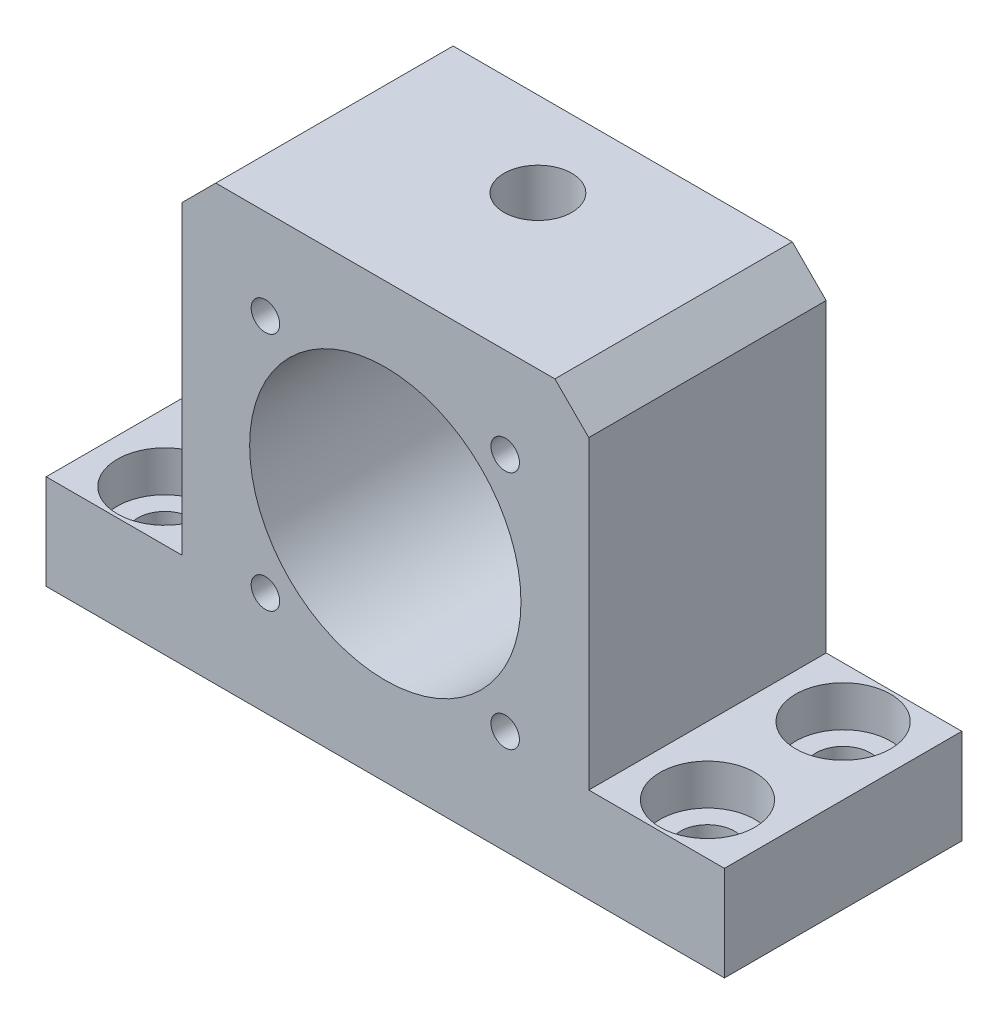
from build123d import *

# Parameters (mm, degrees)
SKETCH_1_R                   = 20
EXTRUDE_1_DEPTH              = 17.5
HOLE_WIZARD_M6_1_D           = 8
HOLE_WIZARD_M6_1_CBORE_D     = 14
HOLE_WIZARD_M6_1_CBORE_DEPTH = 6
HOLE_WIZARD_M5_1_D           = 4.2
HOLE_WIZARD_M5_1_DEPTH       = 12.4
HOLE_WIZARD_M5_1_TIP         = 1.2618073
CUT_EXTRUDE_2_REACH          = 85.08
CUT_EXTRUDE_2_END_RADIUS     = 20
SKETCH_5_R                   = 5


with BuildPart() as part:
    # 草图1 → 拉伸1 (new, symmetric)
    with BuildSketch(Plane.XY):
        Polygon((30, 14), (50, 14), (50, 0), (-50, 0), (-50, 14), (-30, 14), (-30, 59), (-25, 64), (25, 64), (30, 59), align=None)
        with Locations((0, 33)):
            Circle(SKETCH_1_R, mode=Mode.SUBTRACT)
    extrude(amount=EXTRUDE_1_DEPTH, both=True)

    # M6 六角凹头螺钉的柱形沉头孔1 (through all)
    with Locations(Plane(origin=(-40, 14, 10), x_dir=(0, 0, 1), z_dir=(0, 1, 0))):
        with Locations((0, 0), (-20, 0), (-20, 80), (0, 80)):
            CounterBoreHole(HOLE_WIZARD_M6_1_D / 2, HOLE_WIZARD_M6_1_CBORE_D / 2, HOLE_WIZARD_M6_1_CBORE_DEPTH)

    # M5 螺纹孔1
    with Locations(Plane(origin=(-17.67766953, 15.32233047, 17.5), x_dir=(1, 0, 0), z_dir=(0, 0, 1))):
        with Locations((0, 0), (35.35533906, 0), (35.35533906, 35.35533906), (0, 35.35533906)):
            Hole(HOLE_WIZARD_M5_1_D / 2, depth=HOLE_WIZARD_M5_1_DEPTH)
            with Locations((0, 0, -(HOLE_WIZARD_M5_1_DEPTH + HOLE_WIZARD_M5_1_TIP / 2))):  # 118° drill point
                Cone(0, HOLE_WIZARD_M5_1_D / 2, HOLE_WIZARD_M5_1_TIP, mode=Mode.SUBTRACT)

    # 拉伸2: up to this cylinder (the profile starts outside it)
    cut_extrude_2_end = Plane(origin=(0, 33, -5), z_dir=(0, 0, -1)) * Cylinder(CUT_EXTRUDE_2_END_RADIUS, 211.16, mode=Mode.PRIVATE)
    # 草图5 → 拉伸2 (cut, up to the surface)
    with BuildSketch(Plane(origin=(0, 64, 0), x_dir=(1, 0, 0), z_dir=(0, 1, 0)), mode=Mode.PRIVATE) as cut_extrude_2_sk1:
        with Locations(Location((0, 5, 0), (0, 0, 270))):
            Circle(SKETCH_5_R)
    cut_extrude_2_tool1 = extrude(cut_extrude_2_sk1.sketch, amount=-CUT_EXTRUDE_2_REACH, mode=Mode.PRIVATE) - cut_extrude_2_end
    add(cut_extrude_2_tool1.solids().sort_by_distance((0, 64, -5))[0], mode=Mode.SUBTRACT)


solid = part.part
